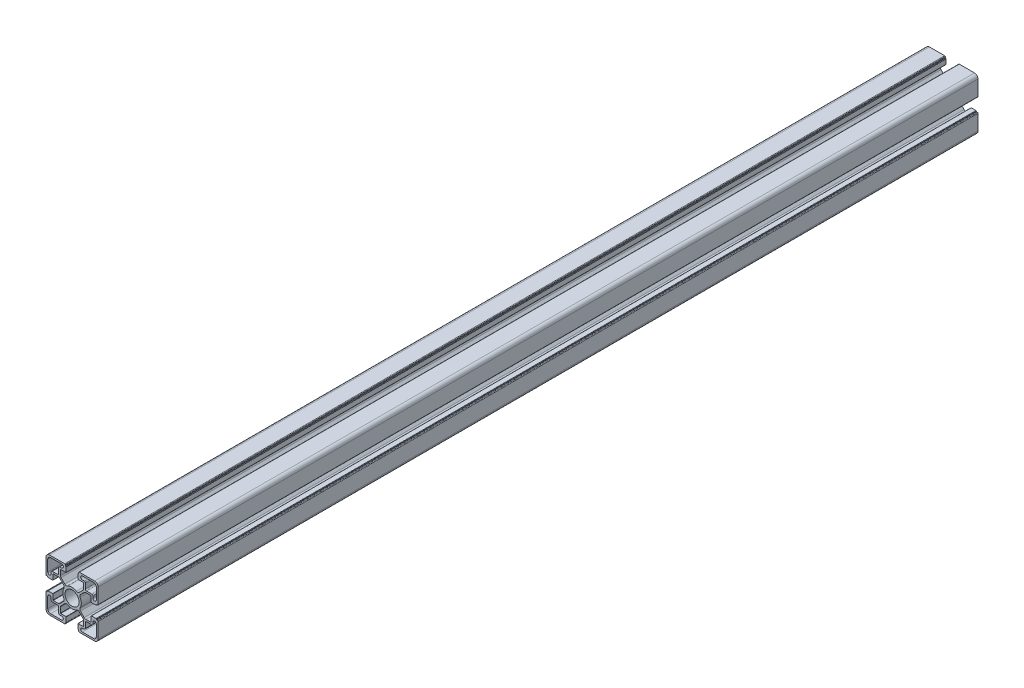
from build123d import *

# Parameters (mm, degrees)
BOSS_EXTRUDE1_DEPTH = 429.35
SCALE2_SCALE_X      = 0.564444
SCALE2_SCALE_Y      = 0.564444
SCALE2_SCALE_Z      = 1


with BuildPart() as part:
    # Sketch1 → Boss-Extrude1 (new body)
    with BuildSketch(Plane.XY):
        with BuildLine():
            Line((-22.5, 19.5), (-22.5, 6.3))
            ThreePointArc((-22.5, 6.3), (-22.353553391, 5.946446609), (-22, 5.8))
            Line((-22, 5.8), (-21.3, 5.8))
            ThreePointArc((-21.3, 5.8), (-21.087867966, 5.712132034), (-21, 5.5))
            Line((-21, 5.5), (-21, 5.3))
            ThreePointArc((-21, 5.3), (-20.912132034, 5.087867966), (-20.7, 5))
            Line((-20.7, 5), (-16.7, 5))
            ThreePointArc((-16.7, 5), (-16.558578644, 5.058578644), (-16.5, 5.2))
            Line((-16.5, 5.2), (-16.5, 9.8))
            ThreePointArc((-16.5, 9.8), (-16.441421356, 9.941421356), (-16.3, 10))
            Line((-16.3, 10), (-11.864234483, 10))
            ThreePointArc((-11.864234483, 10), (-11.121828624, 9.852326293), (-10.492447327, 9.431787156))
            Line((-10.492447327, 9.431787156), (-7.296699127, 6.236038955))
            ThreePointArc((-7.296699127, 6.236038955), (-6.746669172, 5.129240469), (-6.976648919, 3.914890784))
            ThreePointArc((-6.976648919, 3.914890784), (-7.739935121, 2.023216331), (-8, 0))
            ThreePointArc((-8, 0), (-7.739935121, -2.023216331), (-6.976648919, -3.914890784))
            ThreePointArc((-6.976648919, -3.914890784), (-6.746669172, -5.129240469), (-7.296699127, -6.236038955))
            Line((-7.296699127, -6.236038955), (-10.492447327, -9.431787156))
            ThreePointArc((-10.492447327, -9.431787156), (-11.121828624, -9.852326293), (-11.864234483, -10))
            Line((-11.864234483, -10), (-16.3, -10))
            ThreePointArc((-16.3, -10), (-16.441421356, -9.941421356), (-16.5, -9.8))
            Line((-16.5, -9.8), (-16.5, -5.2))
            ThreePointArc((-16.5, -5.2), (-16.558578644, -5.058578644), (-16.7, -5))
            Line((-16.7, -5), (-20.7, -5))
            ThreePointArc((-20.7, -5), (-20.912132034, -5.087867966), (-21, -5.3))
            Line((-21, -5.3), (-21, -5.5))
            ThreePointArc((-21, -5.5), (-21.087867966, -5.712132034), (-21.3, -5.8))
            Line((-21.3, -5.8), (-22, -5.8))
            ThreePointArc((-22, -5.8), (-22.353553391, -5.946446609), (-22.5, -6.3))
            Line((-22.5, -6.3), (-22.5, -19.5))
            ThreePointArc((-22.5, -19.5), (-21.621320344, -21.621320344), (-19.5, -22.5))
            Line((-19.5, -22.5), (-6.3, -22.5))
            ThreePointArc((-6.3, -22.5), (-5.946446609, -22.353553391), (-5.8, -22))
            Line((-5.8, -22), (-5.8, -21.3))
            ThreePointArc((-5.8, -21.3), (-5.712132034, -21.087867966), (-5.5, -21))
            Line((-5.5, -21), (-5.3, -21))
            ThreePointArc((-5.3, -21), (-5.087867966, -20.912132034), (-5, -20.7))
            Line((-5, -20.7), (-5, -16.7))
            ThreePointArc((-5, -16.7), (-5.058578644, -16.558578644), (-5.2, -16.5))
            Line((-5.2, -16.5), (-9.8, -16.5))
            ThreePointArc((-9.8, -16.5), (-9.941421356, -16.441421356), (-10, -16.3))
            Line((-10, -16.3), (-10, -11.864234483))
            ThreePointArc((-10, -11.864234483), (-9.852326293, -11.121828624), (-9.431787156, -10.492447327))
            Line((-9.431787156, -10.492447327), (-6.236038955, -7.296699127))
            ThreePointArc((-6.236038955, -7.296699127), (-5.129240469, -6.746669172), (-3.914890784, -6.976648919))
            ThreePointArc((-3.914890784, -6.976648919), (-2.023216331, -7.739935121), (0, -8))
            ThreePointArc((0, -8), (2.023216331, -7.739935121), (3.914890784, -6.976648919))
            ThreePointArc((3.914890784, -6.976648919), (5.129240469, -6.746669172), (6.236038955, -7.296699127))
            Line((6.236038955, -7.296699127), (9.431787156, -10.492447327))
            ThreePointArc((9.431787156, -10.492447327), (9.852326293, -11.121828624), (10, -11.864234483))
            Line((10, -11.864234483), (10, -16.3))
            ThreePointArc((10, -16.3), (9.941421356, -16.441421356), (9.8, -16.5))
            Line((9.8, -16.5), (5.2, -16.5))
            ThreePointArc((5.2, -16.5), (5.058578644, -16.558578644), (5, -16.7))
            Line((5, -16.7), (5, -20.7))
            ThreePointArc((5, -20.7), (5.087867966, -20.912132034), (5.3, -21))
            Line((5.3, -21), (5.5, -21))
            ThreePointArc((5.5, -21), (5.712132034, -21.087867966), (5.8, -21.3))
            Line((5.8, -21.3), (5.8, -22))
            ThreePointArc((5.8, -22), (5.946446609, -22.353553391), (6.3, -22.5))
            Line((6.3, -22.5), (19.5, -22.5))
            ThreePointArc((19.5, -22.5), (21.621320344, -21.621320344), (22.5, -19.5))
            Line((22.5, -19.5), (22.5, -6.3))
            ThreePointArc((22.5, -6.3), (22.353553391, -5.946446609), (22, -5.8))
            Line((22, -5.8), (21.3, -5.8))
            ThreePointArc((21.3, -5.8), (21.087867966, -5.712132034), (21, -5.5))
            Line((21, -5.5), (21, -5.3))
            ThreePointArc((21, -5.3), (20.912132034, -5.087867966), (20.7, -5))
            Line((20.7, -5), (16.7, -5))
            ThreePointArc((16.7, -5), (16.558578644, -5.058578644), (16.5, -5.2))
            Line((16.5, -5.2), (16.5, -9.8))
            ThreePointArc((16.5, -9.8), (16.441421356, -9.941421356), (16.3, -10))
            Line((16.3, -10), (11.864234483, -10))
            ThreePointArc((11.864234483, -10), (11.121828624, -9.852326293), (10.492447327, -9.431787156))
            Line((10.492447327, -9.431787156), (7.296699127, -6.236038955))
            ThreePointArc((7.296699127, -6.236038955), (6.746669172, -5.129240469), (6.976648919, -3.914890784))
            ThreePointArc((6.976648919, -3.914890784), (7.739935121, -2.023216331), (8, 0))
            ThreePointArc((8, 0), (7.739935121, 2.023216331), (6.976648919, 3.914890784))
            ThreePointArc((6.976648919, 3.914890784), (6.746669172, 5.129240469), (7.296699127, 6.236038955))
            Line((7.296699127, 6.236038955), (10.492447327, 9.431787156))
            ThreePointArc((10.492447327, 9.431787156), (11.121828624, 9.852326293), (11.864234483, 10))
            Line((11.864234483, 10), (16.3, 10))
            ThreePointArc((16.3, 10), (16.441421356, 9.941421356), (16.5, 9.8))
            Line((16.5, 9.8), (16.5, 5.2))
            ThreePointArc((16.5, 5.2), (16.558578644, 5.058578644), (16.7, 5))
            Line((16.7, 5), (20.7, 5))
            ThreePointArc((20.7, 5), (20.912132034, 5.087867966), (21, 5.3))
            Line((21, 5.3), (21, 5.5))
            ThreePointArc((21, 5.5), (21.087867966, 5.712132034), (21.3, 5.8))
            Line((21.3, 5.8), (22, 5.8))
            ThreePointArc((22, 5.8), (22.353553391, 5.946446609), (22.5, 6.3))
            Line((22.5, 6.3), (22.5, 19.5))
            ThreePointArc((22.5, 19.5), (21.621320344, 21.621320344), (19.5, 22.5))
            Line((19.5, 22.5), (6.3, 22.5))
            ThreePointArc((6.3, 22.5), (5.946446609, 22.353553391), (5.8, 22))
            Line((5.8, 22), (5.8, 21.3))
            ThreePointArc((5.8, 21.3), (5.712132034, 21.087867966), (5.5, 21))
            Line((5.5, 21), (5.3, 21))
            ThreePointArc((5.3, 21), (5.087867966, 20.912132034), (5, 20.7))
            Line((5, 20.7), (5, 16.7))
            ThreePointArc((5, 16.7), (5.058578644, 16.558578644), (5.2, 16.5))
            Line((5.2, 16.5), (9.8, 16.5))
            ThreePointArc((9.8, 16.5), (9.941421356, 16.441421356), (10, 16.3))
            Line((10, 16.3), (10, 11.864234483))
            ThreePointArc((10, 11.864234483), (9.852326293, 11.121828624), (9.431787156, 10.492447327))
            Line((9.431787156, 10.492447327), (6.236038955, 7.296699127))
            ThreePointArc((6.236038955, 7.296699127), (5.129240469, 6.746669172), (3.914890784, 6.976648919))
            ThreePointArc((3.914890784, 6.976648919), (2.023216331, 7.739935121), (0, 8))
            ThreePointArc((0, 8), (-2.023216331, 7.739935121), (-3.914890784, 6.976648919))
            ThreePointArc((-3.914890784, 6.976648919), (-5.129240469, 6.746669172), (-6.236038955, 7.296699127))
            Line((-6.236038955, 7.296699127), (-9.431787156, 10.492447327))
            ThreePointArc((-9.431787156, 10.492447327), (-9.852326293, 11.121828624), (-10, 11.864234483))
            Line((-10, 11.864234483), (-10, 16.3))
            ThreePointArc((-10, 16.3), (-9.941421356, 16.441421356), (-9.8, 16.5))
            Line((-9.8, 16.5), (-5.2, 16.5))
            ThreePointArc((-5.2, 16.5), (-5.058578644, 16.558578644), (-5, 16.7))
            Line((-5, 16.7), (-5, 20.7))
            ThreePointArc((-5, 20.7), (-5.087867966, 20.912132034), (-5.3, 21))
            Line((-5.3, 21), (-5.5, 21))
            ThreePointArc((-5.5, 21), (-5.712132034, 21.087867966), (-5.8, 21.3))
            Line((-5.8, 21.3), (-5.8, 22))
            ThreePointArc((-5.8, 22), (-5.946446609, 22.353553391), (-6.3, 22.5))
            Line((-6.3, 22.5), (-19.5, 22.5))
            ThreePointArc((-19.5, 22.5), (-21.621320344, 21.621320344), (-22.5, 19.5))
        make_face()
        with BuildLine():
            Line((-21, 18.5), (-21, 9))
            ThreePointArc((-21, 9), (-19.5, 7.5), (-18, 9))
            Line((-18, 9), (-18, 10.5))
            ThreePointArc((-18, 10.5), (-17.707106781, 11.207106781), (-17, 11.5))
            Line((-17, 11.5), (-12.5, 11.5))
            ThreePointArc((-12.5, 11.5), (-11.792893219, 11.792893219), (-11.5, 12.5))
            Line((-11.5, 12.5), (-11.5, 17))
            ThreePointArc((-11.5, 17), (-11.207106781, 17.707106781), (-10.5, 18))
            Line((-10.5, 18), (-9, 18))
            ThreePointArc((-9, 18), (-7.5, 19.5), (-9, 21))
            Line((-9, 21), (-18.5, 21))
            ThreePointArc((-18.5, 21), (-20.267766953, 20.267766953), (-21, 18.5))
        make_face(mode=Mode.SUBTRACT)
        with BuildLine():
            Line((18.5, 21), (9, 21))
            ThreePointArc((9, 21), (7.5, 19.5), (9, 18))
            Line((9, 18), (10.5, 18))
            ThreePointArc((10.5, 18), (11.207106781, 17.707106781), (11.5, 17))
            Line((11.5, 17), (11.5, 12.5))
            ThreePointArc((11.5, 12.5), (11.792893219, 11.792893219), (12.5, 11.5))
            Line((12.5, 11.5), (17, 11.5))
            ThreePointArc((17, 11.5), (17.707106781, 11.207106781), (18, 10.5))
            Line((18, 10.5), (18, 9))
            ThreePointArc((18, 9), (19.5, 7.5), (21, 9))
            Line((21, 9), (21, 18.5))
            ThreePointArc((21, 18.5), (20.267766953, 20.267766953), (18.5, 21))
        make_face(mode=Mode.SUBTRACT)
        with BuildLine():
            Line((21, -18.5), (21, -9))
            ThreePointArc((21, -9), (19.5, -7.5), (18, -9))
            Line((18, -9), (18, -10.5))
            ThreePointArc((18, -10.5), (17.707106781, -11.207106781), (17, -11.5))
            Line((17, -11.5), (12.5, -11.5))
            ThreePointArc((12.5, -11.5), (11.792893219, -11.792893219), (11.5, -12.5))
            Line((11.5, -12.5), (11.5, -17))
            ThreePointArc((11.5, -17), (11.207106781, -17.707106781), (10.5, -18))
            Line((10.5, -18), (9, -18))
            ThreePointArc((9, -18), (7.5, -19.5), (9, -21))
            Line((9, -21), (18.5, -21))
            ThreePointArc((18.5, -21), (20.267766953, -20.267766953), (21, -18.5))
        make_face(mode=Mode.SUBTRACT)
        with BuildLine():
            Line((-18.5, -21), (-9, -21))
            ThreePointArc((-9, -21), (-7.5, -19.5), (-9, -18))
            Line((-9, -18), (-10.5, -18))
            ThreePointArc((-10.5, -18), (-11.207106781, -17.707106781), (-11.5, -17))
            Line((-11.5, -17), (-11.5, -12.5))
            ThreePointArc((-11.5, -12.5), (-11.792893219, -11.792893219), (-12.5, -11.5))
            Line((-12.5, -11.5), (-17, -11.5))
            ThreePointArc((-17, -11.5), (-17.707106781, -11.207106781), (-18, -10.5))
            Line((-18, -10.5), (-18, -9))
            ThreePointArc((-18, -9), (-19.5, -7.5), (-21, -9))
            Line((-21, -9), (-21, -18.5))
            ThreePointArc((-21, -18.5), (-20.267766953, -20.267766953), (-18.5, -21))
        make_face(mode=Mode.SUBTRACT)
        with BuildLine():
            ThreePointArc((0, 6.1), (-4.313351365, 4.313351365), (-6.1, 0))
            ThreePointArc((-6.1, 0), (-4.313351365, -4.313351365), (0, -6.1))
            ThreePointArc((0, -6.1), (4.313351365, -4.313351365), (6.1, 0))
            ThreePointArc((6.1, 0), (4.313351365, 4.313351365), (0, 6.1))
        make_face(mode=Mode.SUBTRACT)
    extrude(amount=BOSS_EXTRUDE1_DEPTH)


with BuildPart() as part_1:
    # Scale2: scaled about (0, 0, 214.675)
    add(part.part.scale((SCALE2_SCALE_X, SCALE2_SCALE_Y, SCALE2_SCALE_Z), about=(0, 0, 214.675)))


solid = part_1.part
